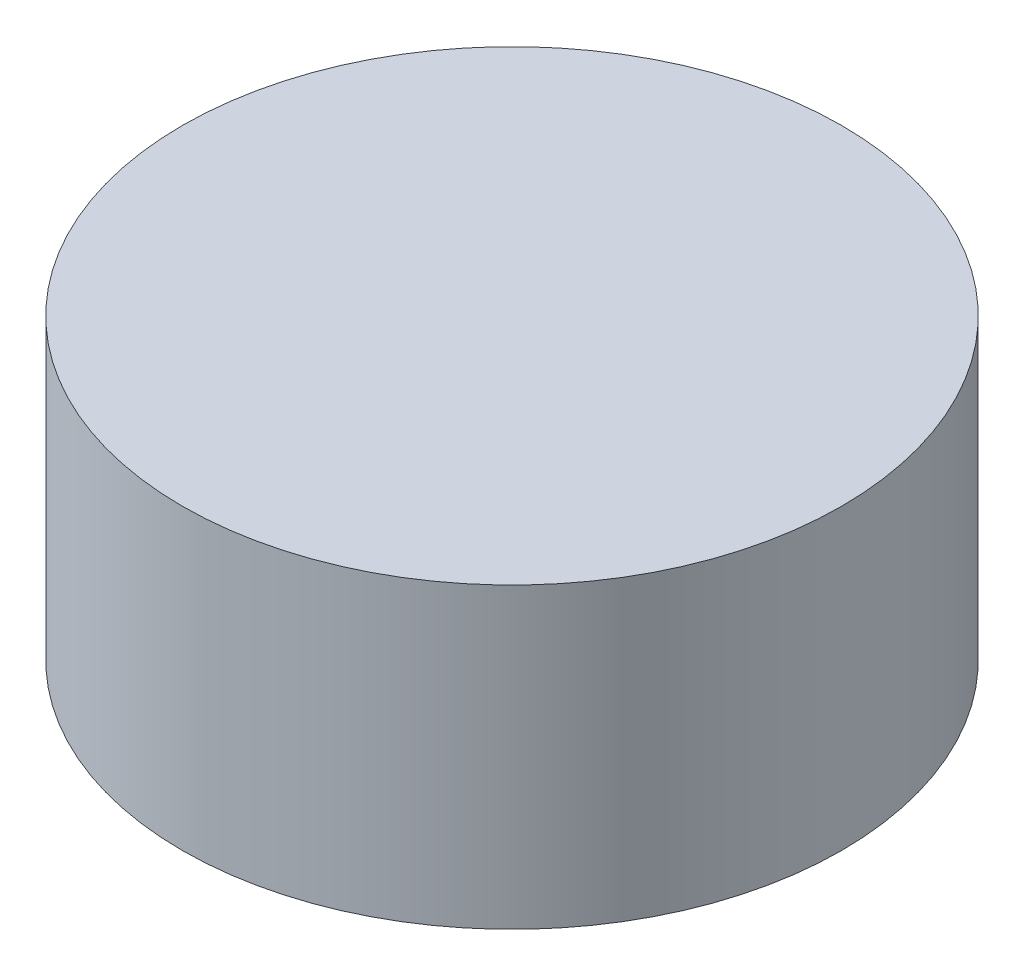
from build123d import *

# Parameters (mm, degrees)
SKETCH1_R           = 16.585725754
BOSS_EXTRUDE1_DEPTH = 15


with BuildPart() as part:
    # Sketch1 → Boss-Extrude1 (new body)
    with BuildSketch(Plane(origin=(0, 0, 0), x_dir=(1, 0, 0), z_dir=(0, 1, 0))):
        with Locations(Location((-19.890791739, 20.670822788, 0), (0, 0, 270))):
            Circle(SKETCH1_R)
    extrude(amount=BOSS_EXTRUDE1_DEPTH)


solid = part.part
